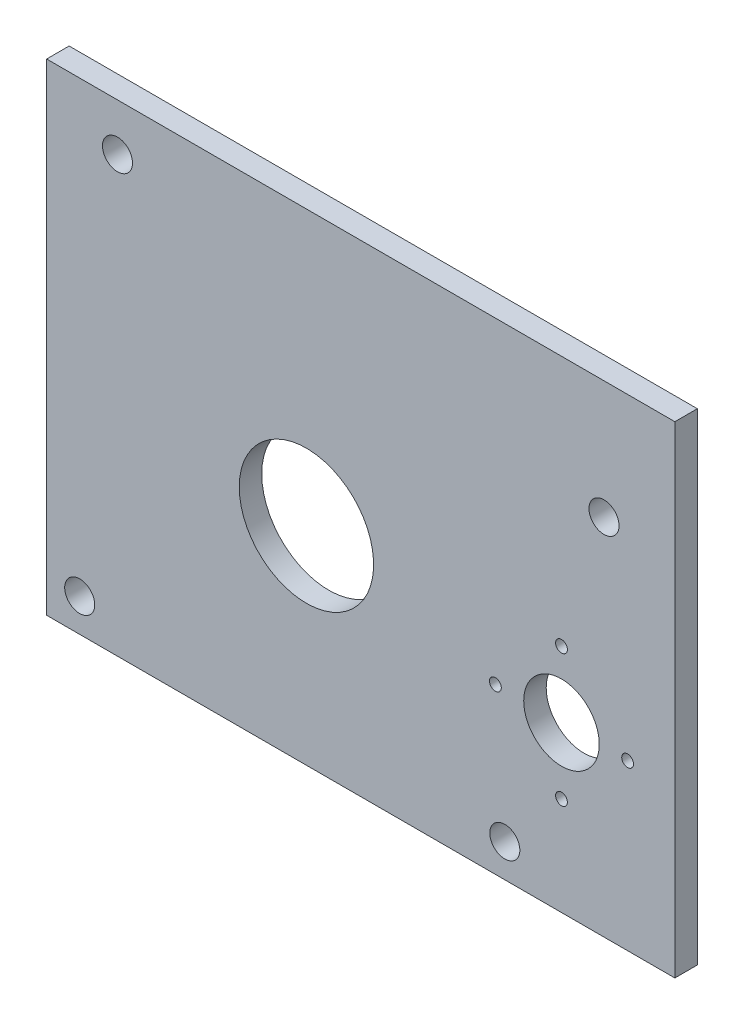
from build123d import *

# Parameters (mm, degrees)
SKETCH1_W           = 133
SKETCH1_H           = 102
SKETCH1_R           = 14.225
SKETCH1_R_2         = 1.25
SKETCH1_R_3         = 8
BOSS_EXTRUDE2_DEPTH = 4.7625
CUT_EXTRUDE1_REACH  = 113.1
SKETCH2_R           = 3.18


with BuildPart() as part:
    # Sketch1 → Boss-Extrude2 (new body)
    with BuildSketch(Plane.XY):
        with Locations((-18.535460993, 20.341271178)):
            Rectangle(SKETCH1_W, SKETCH1_H)
        with Locations(Location((-30.035460993, 13.261258957, 0), (0, 0, 180))):
            Circle(SKETCH1_R, mode=Mode.SUBTRACT)
        with Locations(Location((23.965174075, -9.826590747, 0), (0, 0, 180))):
            Circle(SKETCH1_R_2, mode=Mode.SUBTRACT)
        with Locations(Location((37.965174075, 4.173409253, 0), (0, 0, 180))):
            Circle(SKETCH1_R_2, mode=Mode.SUBTRACT)
        with Locations(Location((23.965174075, 18.173409253, 0), (0, 0, 180))):
            Circle(SKETCH1_R_2, mode=Mode.SUBTRACT)
        with Locations(Location((9.965174075, 4.173409253, 0), (0, 0, 180))):
            Circle(SKETCH1_R_2, mode=Mode.SUBTRACT)
        with Locations(Location((23.965174075, 4.173409253, 0), (0, 0, 180))):
            Circle(SKETCH1_R_3, mode=Mode.SUBTRACT)
    extrude(amount=BOSS_EXTRUDE2_DEPTH)

    # Sketch2 → Cut-Extrude1 (cut, up to next)
    with BuildSketch(Plane.XY.offset(4.7625), mode=Mode.PRIVATE) as cut_extrude1_sk1:
        with Locations((-70.035460993, 61.341271178)):
            Circle(SKETCH2_R)
    cut_extrude1_tool1 = extrude(cut_extrude1_sk1.sketch, amount=-CUT_EXTRUDE1_REACH, mode=Mode.PRIVATE) & part.part
    # Sketch2 → Cut-Extrude1 (cut, up to next)
    with BuildSketch(Plane.XY.offset(4.7625), mode=Mode.PRIVATE) as cut_extrude1_sk2:
        with Locations((32.964539007, 46.341271178)):
            Circle(SKETCH2_R)
    cut_extrude1_tool2 = extrude(cut_extrude1_sk2.sketch, amount=-CUT_EXTRUDE1_REACH, mode=Mode.PRIVATE) & part.part
    # Sketch2 → Cut-Extrude1 (cut, up to next)
    with BuildSketch(Plane.XY.offset(4.7625), mode=Mode.PRIVATE) as cut_extrude1_sk3:
        with Locations((11.964539007, -23.658728822)):
            Circle(SKETCH2_R)
    cut_extrude1_tool3 = extrude(cut_extrude1_sk3.sketch, amount=-CUT_EXTRUDE1_REACH, mode=Mode.PRIVATE) & part.part
    # Sketch2 → Cut-Extrude1 (cut, up to next)
    with BuildSketch(Plane.XY.offset(4.7625), mode=Mode.PRIVATE) as cut_extrude1_sk4:
        with Locations((-78.035460993, -23.658728822)):
            Circle(SKETCH2_R)
    cut_extrude1_tool4 = extrude(cut_extrude1_sk4.sketch, amount=-CUT_EXTRUDE1_REACH, mode=Mode.PRIVATE) & part.part
    add(cut_extrude1_tool1.solids().sort_by_distance((-70.035461, 61.341271, 4.7625))[0], mode=Mode.SUBTRACT)
    add(cut_extrude1_tool2.solids().sort_by_distance((32.964539, 46.341271, 4.7625))[0], mode=Mode.SUBTRACT)
    add(cut_extrude1_tool3.solids().sort_by_distance((11.964539, -23.658729, 4.7625))[0], mode=Mode.SUBTRACT)
    add(cut_extrude1_tool4.solids().sort_by_distance((-78.035461, -23.658729, 4.7625))[0], mode=Mode.SUBTRACT)


solid = part.part
